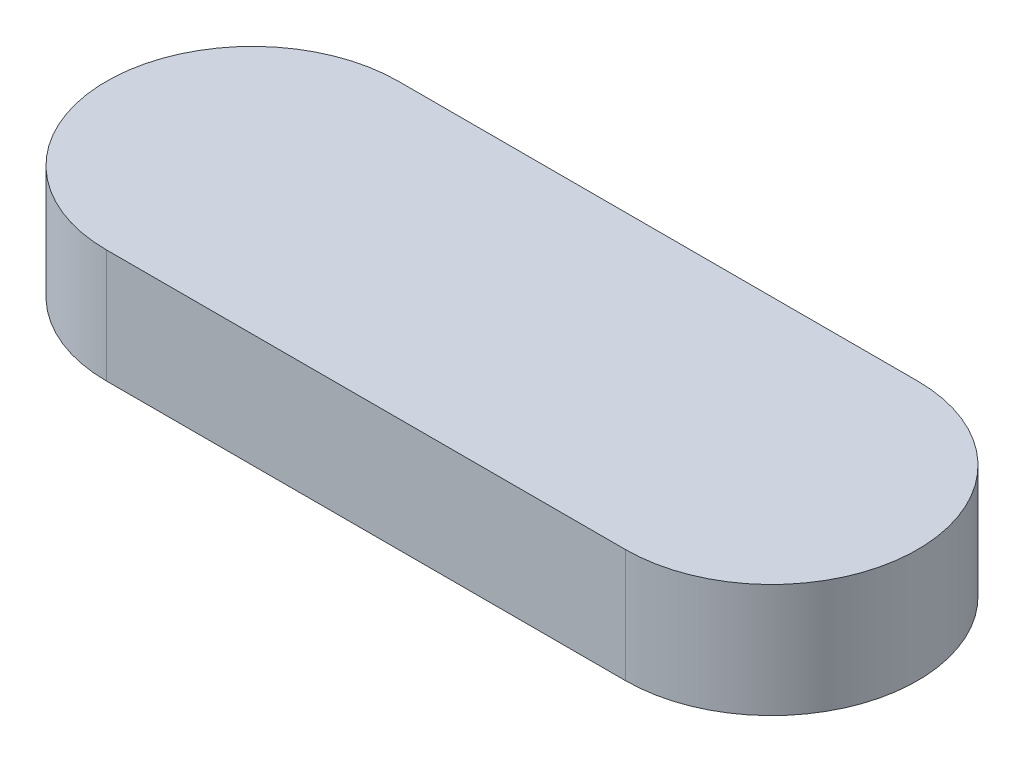
from build123d import *

# Parameters (mm, degrees)
BOSS_EXTRUDE1_DEPTH = 7


with BuildPart() as part:
    # Sketch1 → Boss-Extrude1 (new body)
    with BuildSketch(Plane(origin=(0, 0, 0), x_dir=(1, 0, 0), z_dir=(0, 1, 0))):
        with BuildLine():
            Line((16, -9), (-16, -9))
            ThreePointArc((-16, -9), (-25, 0), (-16, 9))
            Line((-16, 9), (16, 9))
            ThreePointArc((16, 9), (25, 0), (16, -9))
        make_face()
    extrude(amount=BOSS_EXTRUDE1_DEPTH)


solid = part.part
